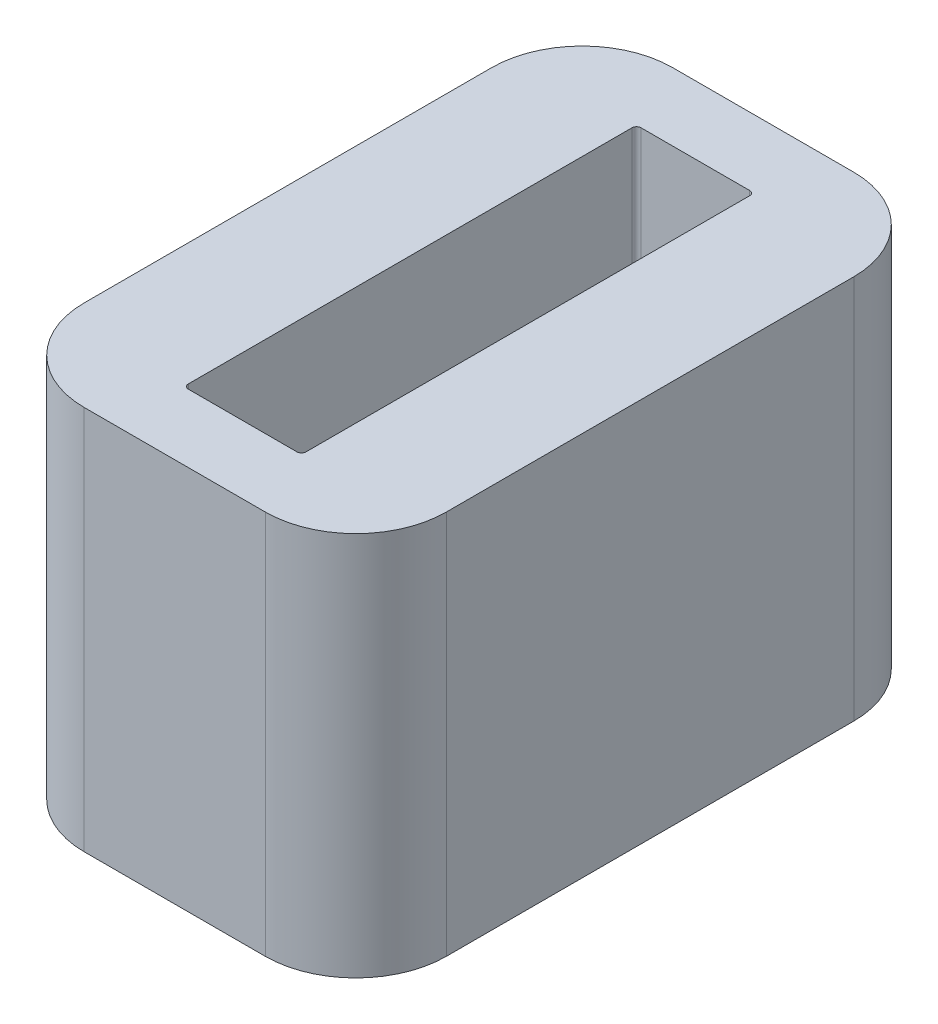
from build123d import *

# Parameters (mm, degrees)
COIL_START = -0.7
SKETCH1_W  = 2.6
SKETCH1_H  = 10
COIL_DEPTH = 8.5
FILLET1_R  = 0.1


with BuildPart() as part:
    # Sketch1 → Coil (new body)
    with BuildSketch(Plane(origin=(0, 97.279475289, 0), x_dir=(1, 0, 0), z_dir=(0, 1, 0)).offset(COIL_START)):
        with BuildLine():
            Line((87.072792821, 67.609367759), (91.072792821, 67.609367759))
            ThreePointArc((91.072792821, 67.609367759), (92.487006384, 68.195154196), (93.072792821, 69.609367759))
            Line((93.072792821, 69.609367759), (93.072792821, 78.609367759))
            ThreePointArc((93.072792821, 78.609367759), (92.487006384, 80.023581321), (91.072792821, 80.609367759))
            Line((91.072792821, 80.609367759), (87.072792821, 80.609367759))
            ThreePointArc((87.072792821, 80.609367759), (85.658579259, 80.023581321), (85.072792821, 78.609367759))
            Line((85.072792821, 78.609367759), (85.072792821, 69.609367759))
            ThreePointArc((85.072792821, 69.609367759), (85.658579259, 68.195154196), (87.072792821, 67.609367759))
        make_face()
        with Locations((89.072792821, 74.109367759)):
            Rectangle(SKETCH1_W, SKETCH1_H, mode=Mode.SUBTRACT)
    extrude(amount=-COIL_DEPTH)

    # Fillet1
    fillet1_edges = [part.edges().sort_by_distance(p)[0] for p in [
        (90.372792821, 92.329475289, -79.109367759),
        (90.372792821, 92.329475289, -69.109367759),
        (87.772792821, 92.329475289, -69.109367759),
        (87.772792821, 92.329475289, -79.109367759),
    ]]
    fillet(fillet1_edges, radius=FILLET1_R)


solid = part.part
